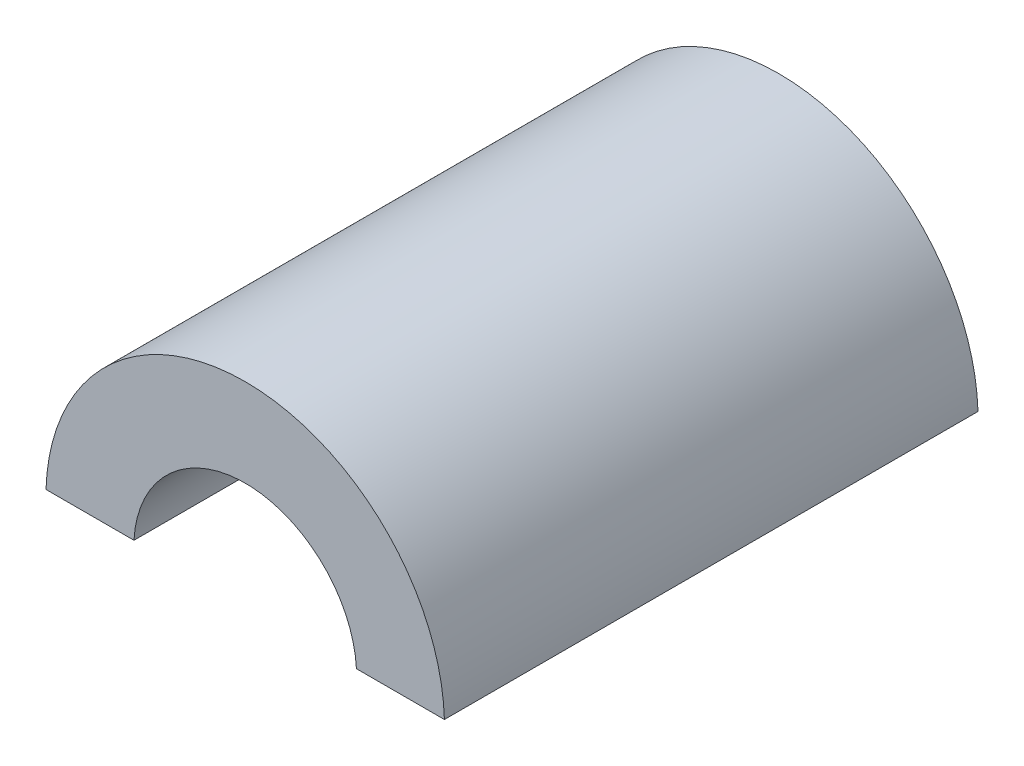
from build123d import *

# Parameters (mm, degrees)
BOSS_EXTRUDE1_DEPTH = 85


with BuildPart() as part:
    # Sketch1 → Boss-Extrude1 (new body)
    with BuildSketch(Plane.XY):
        with BuildLine():
            Line((-31.734248061, 1), (-17.721808598, 1))
            ThreePointArc((-17.721808598, 1), (0, 17.75), (17.721808598, 1))
            Line((17.721808598, 1), (31.734248061, 1))
            ThreePointArc((31.734248061, 1), (0, 31.75), (-31.734248061, 1))
        make_face()
    extrude(amount=BOSS_EXTRUDE1_DEPTH)


solid = part.part
